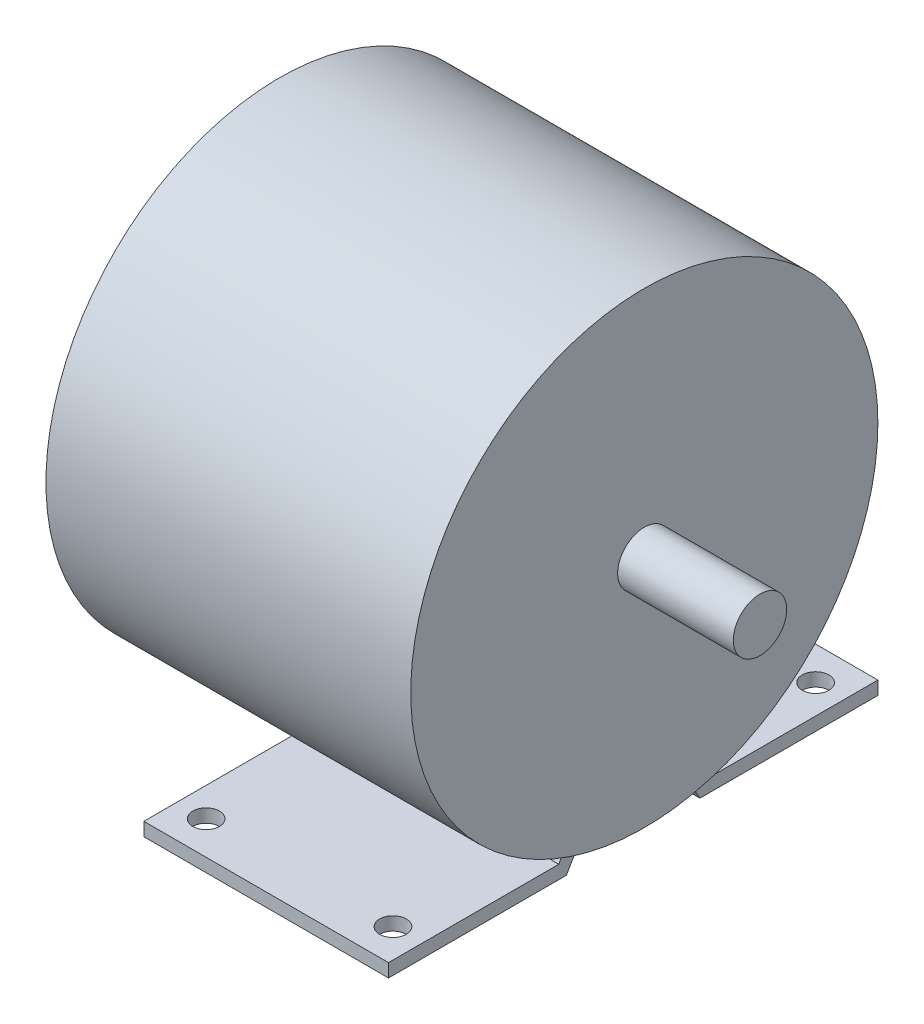
from build123d import *

# Parameters (mm, degrees)
SKETCH1_R           = 52.5
BOSS_EXTRUDE1_DEPTH = 82
SKETCH2_R           = 6
BOSS_EXTRUDE2_DEPTH = 26
BOSS_EXTRUDE3_START = -55
BOSS_EXTRUDE3_DEPTH = 55
CUT_EXTRUDE1_REACH  = 164.336
SKETCH4_R           = 3


with BuildPart() as part:
    # Sketch1 → Boss-Extrude1 (new body)
    with BuildSketch(Plane(origin=(0, 0, 0), x_dir=(0, 0, -1), z_dir=(1, 0, 0))):
        Circle(SKETCH1_R)
    extrude(amount=BOSS_EXTRUDE1_DEPTH)

    # Sketch2 → Boss-Extrude2 (add)
    with BuildSketch(Plane(origin=(82, 0, 0), x_dir=(0, 0, -1), z_dir=(1, 0, 0))):
        with Locations(Location((0, 0, 0), (0, 0, 180))):
            Circle(SKETCH2_R)
    extrude(amount=BOSS_EXTRUDE2_DEPTH)

    # Sketch3 → Boss-Extrude3 (add)
    with BuildSketch(Plane(origin=(79.5, 0, 0), x_dir=(0, 0, -1), z_dir=(1, 0, 0)).offset(BOSS_EXTRUDE3_START)):
        with BuildLine():
            Line((-55, -52.5), (-16.732050808, -52.5))
            Line((-16.732050808, -52.5), (-15.398880082, -50.190880568))
            ThreePointArc((-15.398880082, -50.190880568), (-13.910046874, -50.623715746), (-12.409081478, -51.012397482))
            Line((-12.409081478, -51.012397482), (-15, -55.5))
            Line((-15, -55.5), (-55, -55.5))
            Line((-55, -55.5), (-55, -52.5))
        make_face()
        with BuildLine():
            Line((16.732050808, -52.5), (15.398880082, -50.190880568))
            ThreePointArc((15.398880082, -50.190880568), (13.910046874, -50.623715746), (12.409081478, -51.012397482))
            Line((12.409081478, -51.012397482), (15, -55.5))
            Line((15, -55.5), (55, -55.5))
            Line((55, -55.5), (55, -52.5))
            Line((55, -52.5), (16.732050808, -52.5))
        make_face()
    extrude(amount=BOSS_EXTRUDE3_DEPTH)

    # Sketch4 → Cut-Extrude1 (cut, up to next)
    with BuildSketch(Plane.XZ.offset(55.5), mode=Mode.PRIVATE) as cut_extrude1_sk1:
        with Locations(Location((73, 47.5, 0), (0, 0, 270))):
            Circle(SKETCH4_R)
    cut_extrude1_tool1 = extrude(cut_extrude1_sk1.sketch, amount=-CUT_EXTRUDE1_REACH, mode=Mode.PRIVATE) & part.part
    # Sketch4 → Cut-Extrude1 (cut, up to next)
    with BuildSketch(Plane.XZ.offset(55.5), mode=Mode.PRIVATE) as cut_extrude1_sk2:
        with Locations(Location((73, -47.5, 0), (0, 0, 90))):
            Circle(SKETCH4_R)
    cut_extrude1_tool2 = extrude(cut_extrude1_sk2.sketch, amount=-CUT_EXTRUDE1_REACH, mode=Mode.PRIVATE) & part.part
    # Sketch4 → Cut-Extrude1 (cut, up to next)
    with BuildSketch(Plane.XZ.offset(55.5), mode=Mode.PRIVATE) as cut_extrude1_sk3:
        with Locations(Location((31, -47.5, 0), (0, 0, 90))):
            Circle(SKETCH4_R)
    cut_extrude1_tool3 = extrude(cut_extrude1_sk3.sketch, amount=-CUT_EXTRUDE1_REACH, mode=Mode.PRIVATE) & part.part
    # Sketch4 → Cut-Extrude1 (cut, up to next)
    with BuildSketch(Plane.XZ.offset(55.5), mode=Mode.PRIVATE) as cut_extrude1_sk4:
        with Locations(Location((31, 47.5, 0), (0, 0, 270))):
            Circle(SKETCH4_R)
    cut_extrude1_tool4 = extrude(cut_extrude1_sk4.sketch, amount=-CUT_EXTRUDE1_REACH, mode=Mode.PRIVATE) & part.part
    add(cut_extrude1_tool1.solids().sort_by_distance((73, -55.5, 47.5))[0], mode=Mode.SUBTRACT)
    add(cut_extrude1_tool2.solids().sort_by_distance((73, -55.5, -47.5))[0], mode=Mode.SUBTRACT)
    add(cut_extrude1_tool3.solids().sort_by_distance((31, -55.5, -47.5))[0], mode=Mode.SUBTRACT)
    add(cut_extrude1_tool4.solids().sort_by_distance((31, -55.5, 47.5))[0], mode=Mode.SUBTRACT)


solid = part.part
